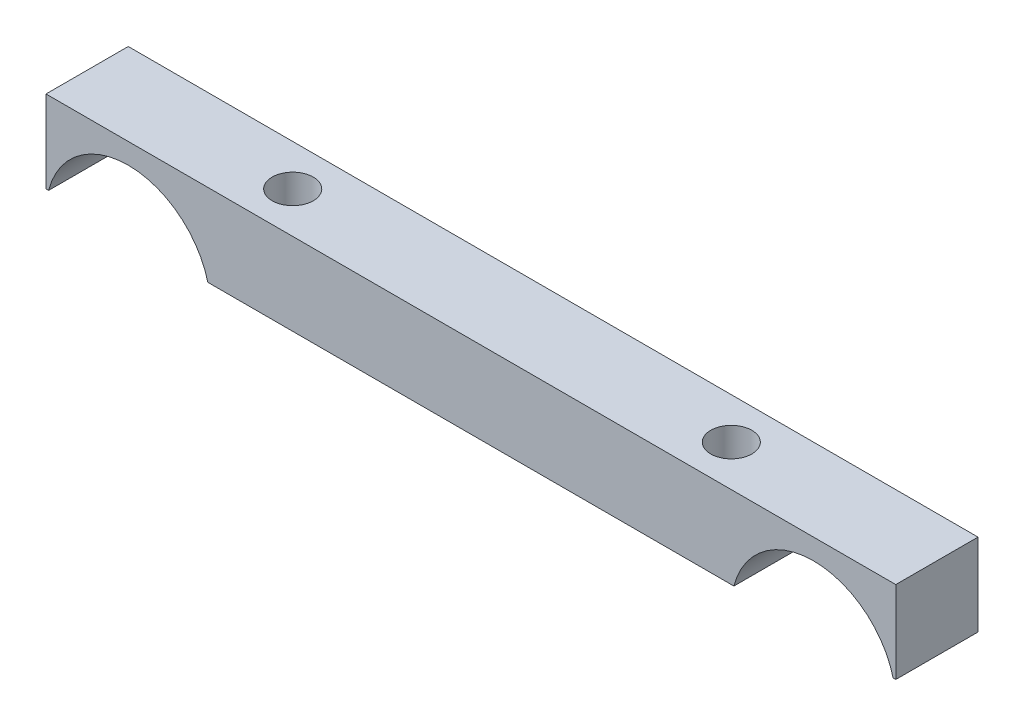
from build123d import *

# Parameters (mm, degrees)
BOSS_EXTRU_1_DEPTH      = 6
ESQUISSE2_R             = 1.5
ENL_V_MAT_EXTRU_1_DEPTH = 6


with BuildPart() as part:
    # Esquisse1 → Boss.-Extru.1 (new body)
    with BuildSketch(Plane.XY):
        with BuildLine():
            Line((-31, 1.5), (-31, 7.5))
            Line((-31, 7.5), (31, 7.5))
            Line((31, 7.5), (31, 1.5))
            Line((31, 1.5), (30.809475019, 1.5))
            ThreePointArc((30.809475019, 1.5), (25, 6), (19.190524981, 1.5))
            Line((19.190524981, 1.5), (-19.190524981, 1.5))
            ThreePointArc((-19.190524981, 1.5), (-25, 6), (-30.809475019, 1.5))
            Line((-30.809475019, 1.5), (-31, 1.5))
        make_face()
    extrude(amount=BOSS_EXTRU_1_DEPTH)

    # Esquisse2 → Enlèv. mat.-Extru.1 (cut)
    with BuildSketch(Plane(origin=(0, 7.5, 0), x_dir=(1, 0, 0), z_dir=(0, 1, 0))):
        with Locations(Location((-16, -3, 0), (0, 0, 270))):
            Circle(ESQUISSE2_R)
        with Locations(Location((16, -3, 0), (0, 0, 270))):
            Circle(ESQUISSE2_R)
    extrude(amount=-ENL_V_MAT_EXTRU_1_DEPTH, mode=Mode.SUBTRACT)


solid = part.part
